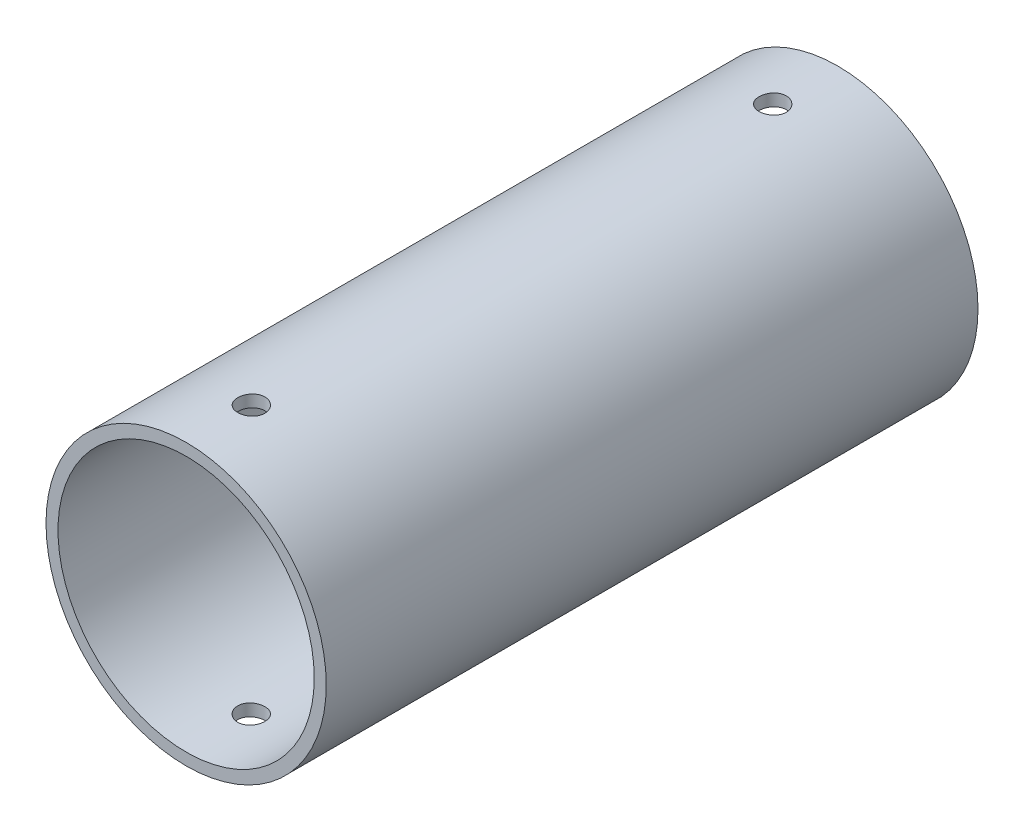
from build123d import *

# Parameters (mm, degrees)
ESBO_O2_R                = 25.8
ESBO_O2_R_2              = 23.59
RESSALTO_EXTRUS_O1_DEPTH = 120
CUT_EXTRUDE1_DEPTH       = 126.42439954
CUT_EXTRUDE1_DEPTH_BACK  = 126.42439954
SKETCH1_R                = 2.5


with BuildPart() as part:
    # Esboço2 → Ressalto-extrusão1 (new body)
    with BuildSketch(Plane.XY):
        Circle(ESBO_O2_R)
        Circle(ESBO_O2_R_2, mode=Mode.SUBTRACT)
    extrude(amount=RESSALTO_EXTRUS_O1_DEPTH)

    # Sketch1 → Cut-Extrude1 (cut, two sides: drawn at the far end of the back side and taken through both)
    with BuildSketch(Plane(origin=(0, 0, 0), x_dir=(1, 0, 0), z_dir=(0, 1, 0)).offset(-CUT_EXTRUDE1_DEPTH_BACK)):
        with Locations(Location((0, -108, 0), (0, 0, 270))):
            Circle(SKETCH1_R)
        with Locations(Location((0, -12, 0), (0, 0, 270))):
            Circle(SKETCH1_R)
    extrude(amount=CUT_EXTRUDE1_DEPTH + CUT_EXTRUDE1_DEPTH_BACK, mode=Mode.SUBTRACT)


solid = part.part
